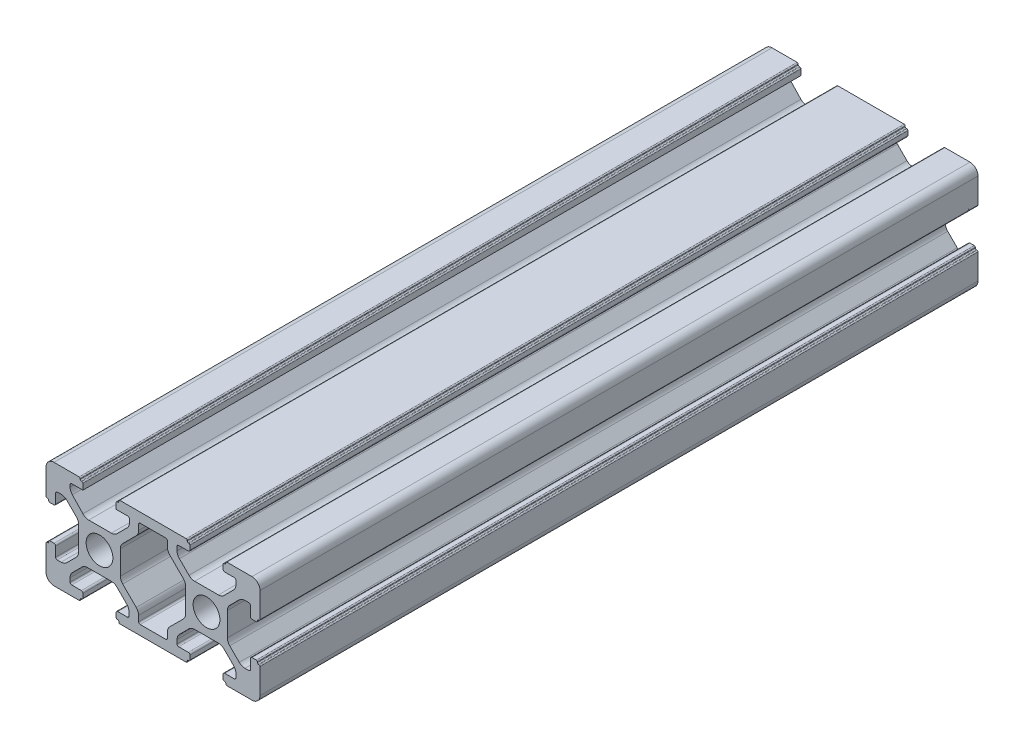
from build123d import *

# Parameters (mm, degrees)
SKETCH1_R           = 2.5
BOSS_EXTRUDE2_DEPTH = 134.2


with BuildPart() as part:
    # Sketch1 → Boss-Extrude2 (new body)
    with BuildSketch(Plane.XY):
        with BuildLine():
            Line((1.5, 0), (6.2, 0))
            ThreePointArc((6.2, 0), (6.341421356, 0.058578644), (6.4, 0.2))
            Line((6.4, 0.2), (6.4, 0.3))
            ThreePointArc((6.4, 0.3), (6.458578644, 0.441421356), (6.6, 0.5))
            Line((6.6, 0.5), (6.7, 0.5))
            ThreePointArc((6.7, 0.5), (6.841421356, 0.558578644), (6.9, 0.7))
            Line((6.9, 0.7), (6.9, 1.5))
            ThreePointArc((6.9, 1.5), (6.812132034, 1.712132034), (6.6, 1.8))
            Line((6.6, 1.8), (4.8, 1.8))
            ThreePointArc((4.8, 1.8), (4.587867966, 1.887867966), (4.5, 2.1))
            Line((4.5, 2.1), (4.5, 2.818019485))
            ThreePointArc((4.5, 2.818019485), (4.614180701, 3.392044633), (4.939339828, 3.878679656))
            Line((4.939339828, 3.878679656), (6.721320344, 5.660660172))
            ThreePointArc((6.721320344, 5.660660172), (7.207955367, 5.985819299), (7.781980515, 6.1))
            Line((7.781980515, 6.1), (12.218019485, 6.1))
            ThreePointArc((12.218019485, 6.1), (12.792044633, 5.985819299), (13.278679656, 5.660660172))
            Line((13.278679656, 5.660660172), (15.060660172, 3.878679656))
            ThreePointArc((15.060660172, 3.878679656), (15.385819299, 3.392044633), (15.5, 2.818019485))
            Line((15.5, 2.818019485), (15.5, 2.1))
            ThreePointArc((15.5, 2.1), (15.412132034, 1.887867966), (15.2, 1.8))
            Line((15.2, 1.8), (13.4, 1.8))
            ThreePointArc((13.4, 1.8), (13.187867966, 1.712132034), (13.1, 1.5))
            Line((13.1, 1.5), (13.1, 0.7))
            ThreePointArc((13.1, 0.7), (13.158578644, 0.558578644), (13.3, 0.5))
            Line((13.3, 0.5), (13.4, 0.5))
            ThreePointArc((13.4, 0.5), (13.541421356, 0.441421356), (13.6, 0.3))
            Line((13.6, 0.3), (13.6, 0.2))
            ThreePointArc((13.6, 0.2), (13.658578644, 0.058578644), (13.8, 0))
            Line((13.8, 0), (26.2, 0))
            ThreePointArc((26.2, 0), (26.341421356, 0.058578644), (26.4, 0.2))
            Line((26.4, 0.2), (26.4, 0.3))
            ThreePointArc((26.4, 0.3), (26.458578644, 0.441421356), (26.6, 0.5))
            Line((26.6, 0.5), (26.7, 0.5))
            ThreePointArc((26.7, 0.5), (26.841421356, 0.558578644), (26.9, 0.7))
            Line((26.9, 0.7), (26.9, 1.5))
            ThreePointArc((26.9, 1.5), (26.812132034, 1.712132034), (26.6, 1.8))
            Line((26.6, 1.8), (24.8, 1.8))
            ThreePointArc((24.8, 1.8), (24.587867966, 1.887867966), (24.5, 2.1))
            Line((24.5, 2.1), (24.5, 2.818019485))
            ThreePointArc((24.5, 2.818019485), (24.614180701, 3.392044633), (24.939339828, 3.878679656))
            Line((24.939339828, 3.878679656), (26.721320344, 5.660660172))
            ThreePointArc((26.721320344, 5.660660172), (27.207955367, 5.985819299), (27.781980515, 6.1))
            Line((27.781980515, 6.1), (32.218019485, 6.1))
            ThreePointArc((32.218019485, 6.1), (32.792044633, 5.985819299), (33.278679656, 5.660660172))
            Line((33.278679656, 5.660660172), (35.060660172, 3.878679656))
            ThreePointArc((35.060660172, 3.878679656), (35.385819299, 3.392044633), (35.5, 2.818019485))
            Line((35.5, 2.818019485), (35.5, 2.1))
            ThreePointArc((35.5, 2.1), (35.412132034, 1.887867966), (35.2, 1.8))
            Line((35.2, 1.8), (33.4, 1.8))
            ThreePointArc((33.4, 1.8), (33.187867966, 1.712132034), (33.1, 1.5))
            Line((33.1, 1.5), (33.1, 0.7))
            ThreePointArc((33.1, 0.7), (33.158578644, 0.558578644), (33.3, 0.5))
            Line((33.3, 0.5), (33.4, 0.5))
            ThreePointArc((33.4, 0.5), (33.541421356, 0.441421356), (33.6, 0.3))
            Line((33.6, 0.3), (33.6, 0.2))
            ThreePointArc((33.6, 0.2), (33.658578644, 0.058578644), (33.8, 0))
            Line((33.8, 0), (38.5, 0))
            ThreePointArc((38.5, 0), (39.560660172, 0.439339828), (40, 1.5))
            Line((40, 1.5), (40, 6.2))
            ThreePointArc((40, 6.2), (39.941421356, 6.341421356), (39.8, 6.4))
            Line((39.8, 6.4), (39.7, 6.4))
            ThreePointArc((39.7, 6.4), (39.558578644, 6.458578644), (39.5, 6.6))
            Line((39.5, 6.6), (39.5, 6.7))
            ThreePointArc((39.5, 6.7), (39.441421356, 6.841421356), (39.3, 6.9))
            Line((39.3, 6.9), (38.5, 6.9))
            ThreePointArc((38.5, 6.9), (38.287867966, 6.812132034), (38.2, 6.6))
            Line((38.2, 6.6), (38.2, 4.8))
            ThreePointArc((38.2, 4.8), (38.112132034, 4.587867966), (37.9, 4.5))
            Line((37.9, 4.5), (37.181980515, 4.5))
            ThreePointArc((37.181980515, 4.5), (36.607955367, 4.614180701), (36.121320344, 4.939339828))
            Line((36.121320344, 4.939339828), (34.339339828, 6.721320344))
            ThreePointArc((34.339339828, 6.721320344), (34.014180701, 7.207955367), (33.9, 7.781980515))
            Line((33.9, 7.781980515), (33.9, 12.218019485))
            ThreePointArc((33.9, 12.218019485), (34.014180701, 12.792044633), (34.339339828, 13.278679656))
            Line((34.339339828, 13.278679656), (36.121320344, 15.060660172))
            ThreePointArc((36.121320344, 15.060660172), (36.607955367, 15.385819299), (37.181980515, 15.5))
            Line((37.181980515, 15.5), (37.9, 15.5))
            ThreePointArc((37.9, 15.5), (38.112132034, 15.412132034), (38.2, 15.2))
            Line((38.2, 15.2), (38.2, 13.4))
            ThreePointArc((38.2, 13.4), (38.287867966, 13.187867966), (38.5, 13.1))
            Line((38.5, 13.1), (39.3, 13.1))
            ThreePointArc((39.3, 13.1), (39.441421356, 13.158578644), (39.5, 13.3))
            Line((39.5, 13.3), (39.5, 13.4))
            ThreePointArc((39.5, 13.4), (39.558578644, 13.541421356), (39.7, 13.6))
            Line((39.7, 13.6), (39.8, 13.6))
            ThreePointArc((39.8, 13.6), (39.941421356, 13.658578644), (40, 13.8))
            Line((40, 13.8), (40, 18.5))
            ThreePointArc((40, 18.5), (39.560660172, 19.560660172), (38.5, 20))
            Line((38.5, 20), (33.8, 20))
            ThreePointArc((33.8, 20), (33.658578644, 19.941421356), (33.6, 19.8))
            Line((33.6, 19.8), (33.6, 19.7))
            ThreePointArc((33.6, 19.7), (33.541421356, 19.558578644), (33.4, 19.5))
            Line((33.4, 19.5), (33.3, 19.5))
            ThreePointArc((33.3, 19.5), (33.158578644, 19.441421356), (33.1, 19.3))
            Line((33.1, 19.3), (33.1, 18.5))
            ThreePointArc((33.1, 18.5), (33.187867966, 18.287867966), (33.4, 18.2))
            Line((33.4, 18.2), (35.2, 18.2))
            ThreePointArc((35.2, 18.2), (35.412132034, 18.112132034), (35.5, 17.9))
            Line((35.5, 17.9), (35.5, 17.181980515))
            ThreePointArc((35.5, 17.181980515), (35.385819299, 16.607955367), (35.060660172, 16.121320344))
            Line((35.060660172, 16.121320344), (33.278679656, 14.339339828))
            ThreePointArc((33.278679656, 14.339339828), (32.792044633, 14.014180701), (32.218019485, 13.9))
            Line((32.218019485, 13.9), (27.781980515, 13.9))
            ThreePointArc((27.781980515, 13.9), (27.207955367, 14.014180701), (26.721320344, 14.339339828))
            Line((26.721320344, 14.339339828), (24.939339828, 16.121320344))
            ThreePointArc((24.939339828, 16.121320344), (24.614180701, 16.607955367), (24.5, 17.181980515))
            Line((24.5, 17.181980515), (24.5, 17.9))
            ThreePointArc((24.5, 17.9), (24.587867966, 18.112132034), (24.8, 18.2))
            Line((24.8, 18.2), (26.6, 18.2))
            ThreePointArc((26.6, 18.2), (26.812132034, 18.287867966), (26.9, 18.5))
            Line((26.9, 18.5), (26.9, 19.3))
            ThreePointArc((26.9, 19.3), (26.841421356, 19.441421356), (26.7, 19.5))
            Line((26.7, 19.5), (26.6, 19.5))
            ThreePointArc((26.6, 19.5), (26.458578644, 19.558578644), (26.4, 19.7))
            Line((26.4, 19.7), (26.4, 19.8))
            ThreePointArc((26.4, 19.8), (26.341421356, 19.941421356), (26.2, 20))
            Line((26.2, 20), (13.8, 20))
            ThreePointArc((13.8, 20), (13.658578644, 19.941421356), (13.6, 19.8))
            Line((13.6, 19.8), (13.6, 19.7))
            ThreePointArc((13.6, 19.7), (13.541421356, 19.558578644), (13.4, 19.5))
            Line((13.4, 19.5), (13.3, 19.5))
            ThreePointArc((13.3, 19.5), (13.158578644, 19.441421356), (13.1, 19.3))
            Line((13.1, 19.3), (13.1, 18.2))
            Line((13.1, 18.2), (15.3, 18.2))
            ThreePointArc((15.3, 18.2), (15.512132034, 18.112132034), (15.6, 17.9))
            Line((15.6, 17.9), (15.6, 17.281980515))
            ThreePointArc((15.6, 17.281980515), (15.485819299, 16.707955367), (15.160660172, 16.221320344))
            Line((15.160660172, 16.221320344), (13.278679656, 14.339339828))
            ThreePointArc((13.278679656, 14.339339828), (12.792044633, 14.014180701), (12.218019485, 13.9))
            Line((12.218019485, 13.9), (7.986375635, 13.9))
            ThreePointArc((7.986375635, 13.9), (7.393381044, 14.022191082), (6.896997987, 14.36885678))
            Line((6.896997987, 14.36885678), (4.910622352, 16.467414163))
            ThreePointArc((4.910622352, 16.467414163), (4.606431474, 16.943609851), (4.5, 17.498557383))
            Line((4.5, 17.498557383), (4.5, 17.9))
            ThreePointArc((4.5, 17.9), (4.587867966, 18.112132034), (4.8, 18.2))
            Line((4.8, 18.2), (6.9, 18.2))
            Line((6.9, 18.2), (6.9, 19.3))
            ThreePointArc((6.9, 19.3), (6.841421356, 19.441421356), (6.7, 19.5))
            Line((6.7, 19.5), (6.6, 19.5))
            ThreePointArc((6.6, 19.5), (6.458578644, 19.558578644), (6.4, 19.7))
            Line((6.4, 19.7), (6.4, 19.8))
            ThreePointArc((6.4, 19.8), (6.341421356, 19.941421356), (6.2, 20))
            Line((6.2, 20), (1.5, 20))
            ThreePointArc((1.5, 20), (0.439339828, 19.560660172), (0, 18.5))
            Line((0, 18.5), (0, 13.8))
            ThreePointArc((0, 13.8), (0.058578644, 13.658578644), (0.2, 13.6))
            Line((0.2, 13.6), (0.3, 13.6))
            ThreePointArc((0.3, 13.6), (0.441421356, 13.541421356), (0.5, 13.4))
            Line((0.5, 13.4), (0.5, 13.3))
            ThreePointArc((0.5, 13.3), (0.558578644, 13.158578644), (0.7, 13.1))
            Line((0.7, 13.1), (1.5, 13.1))
            ThreePointArc((1.5, 13.1), (1.712132034, 13.187867966), (1.8, 13.4))
            Line((1.8, 13.4), (1.8, 15.2))
            ThreePointArc((1.8, 15.2), (1.887867966, 15.412132034), (2.1, 15.5))
            Line((2.1, 15.5), (2.818019485, 15.5))
            ThreePointArc((2.818019485, 15.5), (3.392044633, 15.385819299), (3.878679656, 15.060660172))
            Line((3.878679656, 15.060660172), (5.660660172, 13.278679656))
            ThreePointArc((5.660660172, 13.278679656), (5.985819299, 12.792044633), (6.1, 12.218019485))
            Line((6.1, 12.218019485), (6.1, 7.781980515))
            ThreePointArc((6.1, 7.781980515), (5.985819299, 7.207955367), (5.660660172, 6.721320344))
            Line((5.660660172, 6.721320344), (3.878679656, 4.939339828))
            ThreePointArc((3.878679656, 4.939339828), (3.392044633, 4.614180701), (2.818019485, 4.5))
            Line((2.818019485, 4.5), (2.1, 4.5))
            ThreePointArc((2.1, 4.5), (1.887867966, 4.587867966), (1.8, 4.8))
            Line((1.8, 4.8), (1.8, 6.6))
            ThreePointArc((1.8, 6.6), (1.712132034, 6.812132034), (1.5, 6.9))
            Line((1.5, 6.9), (0.7, 6.9))
            ThreePointArc((0.7, 6.9), (0.558578644, 6.841421356), (0.5, 6.7))
            Line((0.5, 6.7), (0.5, 6.6))
            ThreePointArc((0.5, 6.6), (0.441421356, 6.458578644), (0.3, 6.4))
            Line((0.3, 6.4), (0.2, 6.4))
            ThreePointArc((0.2, 6.4), (0.058578644, 6.341421356), (0, 6.2))
            Line((0, 6.2), (0, 1.5))
            ThreePointArc((0, 1.5), (0.439339828, 0.439339828), (1.5, 0))
        make_face()
        with Locations((10, 10)):
            Circle(SKETCH1_R, mode=Mode.SUBTRACT)
        with Locations((30, 10)):
            Circle(SKETCH1_R, mode=Mode.SUBTRACT)
        with BuildLine():
            Line((17.6, 1.8), (22.4, 1.8))
            ThreePointArc((22.4, 1.8), (22.612132034, 1.887867966), (22.7, 2.1))
            Line((22.7, 2.1), (22.7, 3.139339828))
            ThreePointArc((22.7, 3.139339828), (22.814180701, 3.713364977), (23.139339828, 4.2))
            Line((23.139339828, 4.2), (25.660660172, 6.721320344))
            ThreePointArc((25.660660172, 6.721320344), (25.985819299, 7.207955367), (26.1, 7.781980515))
            Line((26.1, 7.781980515), (26.1, 12.218019485))
            ThreePointArc((26.1, 12.218019485), (25.985819299, 12.792044633), (25.660660172, 13.278679656))
            Line((25.660660172, 13.278679656), (23.139339828, 15.8))
            ThreePointArc((23.139339828, 15.8), (22.814180701, 16.286635023), (22.7, 16.860660172))
            Line((22.7, 16.860660172), (22.7, 17.9))
            ThreePointArc((22.7, 17.9), (22.612132034, 18.112132034), (22.4, 18.2))
            Line((22.4, 18.2), (17.6, 18.2))
            ThreePointArc((17.6, 18.2), (17.387867966, 18.112132034), (17.3, 17.9))
            Line((17.3, 17.9), (17.3, 16.860660172))
            ThreePointArc((17.3, 16.860660172), (17.185819299, 16.286635023), (16.860660172, 15.8))
            Line((16.860660172, 15.8), (14.339339828, 13.278679656))
            ThreePointArc((14.339339828, 13.278679656), (14.014180701, 12.792044633), (13.9, 12.218019485))
            Line((13.9, 12.218019485), (13.9, 7.781980515))
            ThreePointArc((13.9, 7.781980515), (14.014180701, 7.207955367), (14.339339828, 6.721320344))
            Line((14.339339828, 6.721320344), (16.860660172, 4.2))
            ThreePointArc((16.860660172, 4.2), (17.185819299, 3.713364977), (17.3, 3.139339828))
            Line((17.3, 3.139339828), (17.3, 2.1))
            ThreePointArc((17.3, 2.1), (17.387867966, 1.887867966), (17.6, 1.8))
        make_face(mode=Mode.SUBTRACT)
    extrude(amount=BOSS_EXTRUDE2_DEPTH)


solid = part.part
